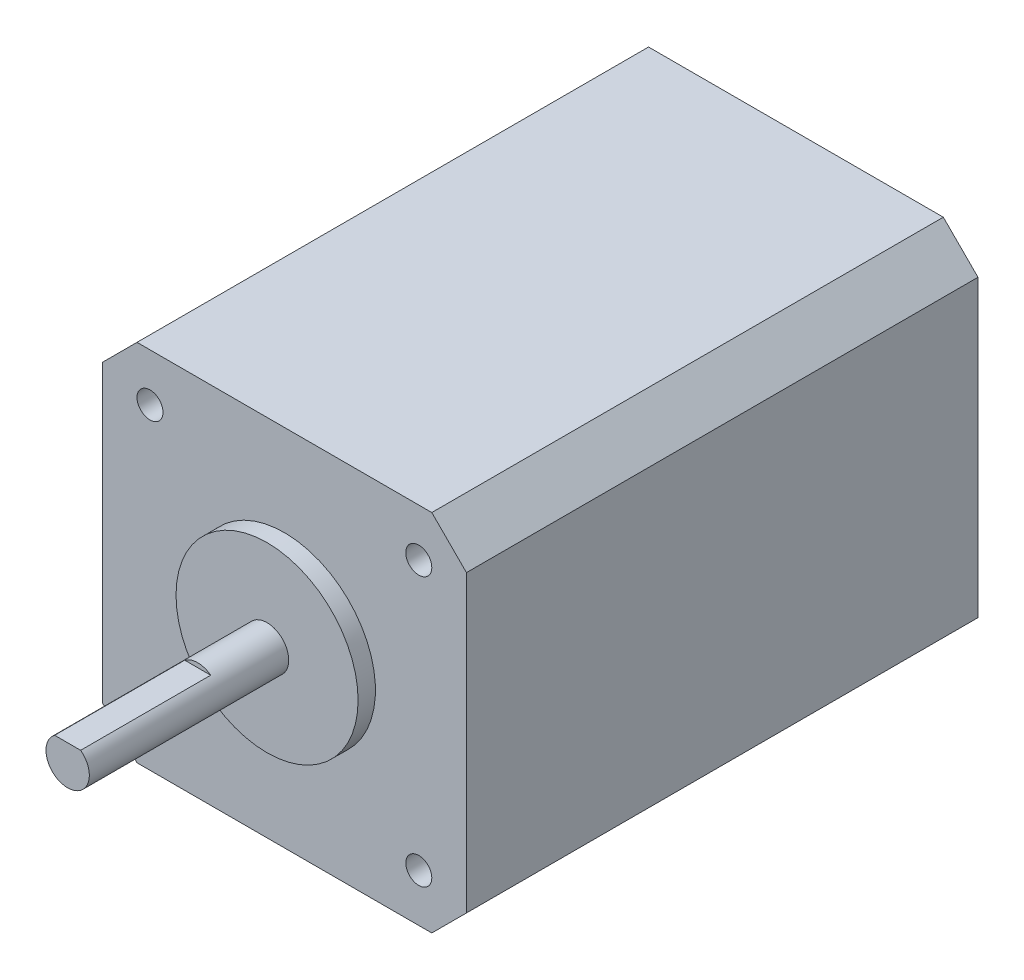
from build123d import *

# Parameters (mm, degrees)
SKIZZE1_R                       = 1.5
AUFSATZ_LINEAR_AUSTRAGEN1_DEPTH = 59
SKIZZE2_R                       = 10.5
AUFSATZ_LINEAR_AUSTRAGEN2_DEPTH = 2
SKIZZE3_R                       = 2.5
AUFSATZ_LINEAR_AUSTRAGEN3_DEPTH = 23
SCHNITT_LINEAR_AUSTRAGEN1_DEPTH = 15


with BuildPart() as part:
    # Skizze1 → Aufsatz-Linear austragen1 (new body)
    with BuildSketch(Plane.XY):
        Polygon((-17, -21), (17, -21), (21, -17), (21, 17), (17, 21), (-17, 21), (-21, 17), (-21, -17), align=None)
        with Locations((15.5, 15.5)):
            Circle(SKIZZE1_R, mode=Mode.SUBTRACT)
        with Locations((15.5, -15.5)):
            Circle(SKIZZE1_R, mode=Mode.SUBTRACT)
        with Locations((-15.5, -15.5)):
            Circle(SKIZZE1_R, mode=Mode.SUBTRACT)
        with Locations((-15.5, 15.5)):
            Circle(SKIZZE1_R, mode=Mode.SUBTRACT)
    extrude(amount=AUFSATZ_LINEAR_AUSTRAGEN1_DEPTH)

    # Skizze2 → Aufsatz-Linear austragen2 (add)
    with BuildSketch(Plane.XY.offset(59)):
        with Locations(Location((0, 0, 0), (0, 0, 180))):
            Circle(SKIZZE2_R)
    extrude(amount=AUFSATZ_LINEAR_AUSTRAGEN2_DEPTH)

    # Skizze3 → Aufsatz-Linear austragen3 (add)
    with BuildSketch(Plane.XY.offset(61)):
        Circle(SKIZZE3_R)
    extrude(amount=AUFSATZ_LINEAR_AUSTRAGEN3_DEPTH)

    # Skizze4 → Schnitt-Linear austragen1 (cut)
    with BuildSketch(Plane.XY.offset(84)):
        Polygon((-75.850602173, 2), (-1.5, 2), (1.5, 2), (75.850602173, 2), (75.850602173, 150.701204346), (-75.850602173, 150.701204346), align=None)
    extrude(amount=-SCHNITT_LINEAR_AUSTRAGEN1_DEPTH, mode=Mode.SUBTRACT)


solid = part.part
